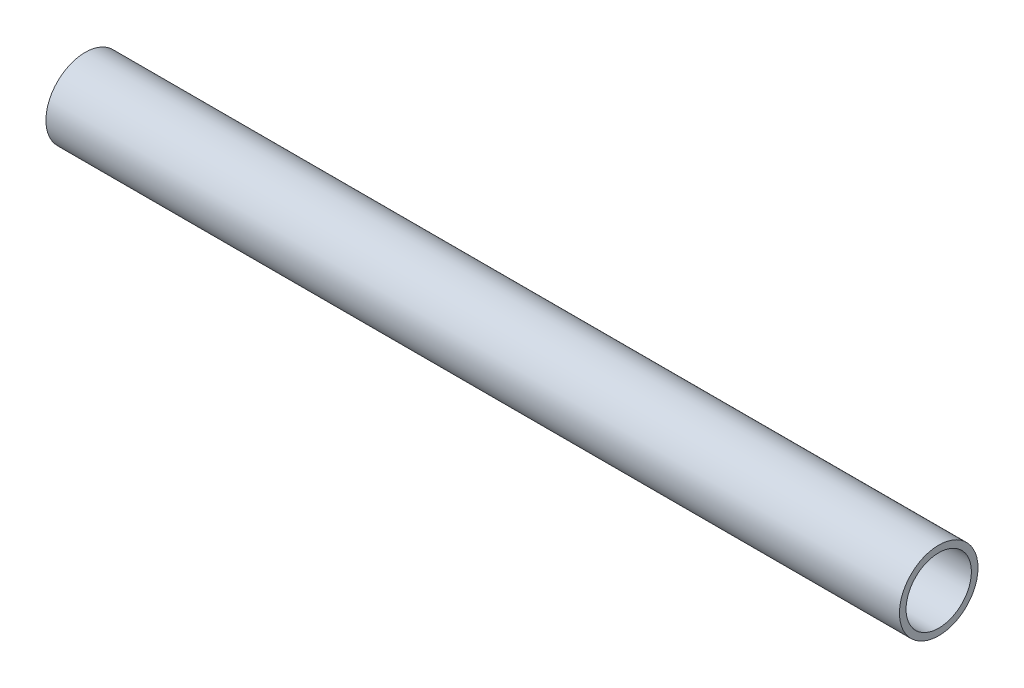
from build123d import *

# Parameters (mm, degrees)
SKETCH11_R              = 6.35
SKETCH11_R_2            = 5.2832
PIPE_0_5_SCH_40_1_DEPTH = 138.013209953


with BuildPart() as part:
    # Sketch11 → Pipe 0.5 SCH 40(1) (new body)
    with BuildSketch(Plane(origin=(-106.534019987, 1471.859674504, 0), x_dir=(0, 1, 0), z_dir=(1, 0, 0))):
        Circle(SKETCH11_R)
        Circle(SKETCH11_R_2, mode=Mode.SUBTRACT)
    extrude(amount=PIPE_0_5_SCH_40_1_DEPTH)


solid = part.part
